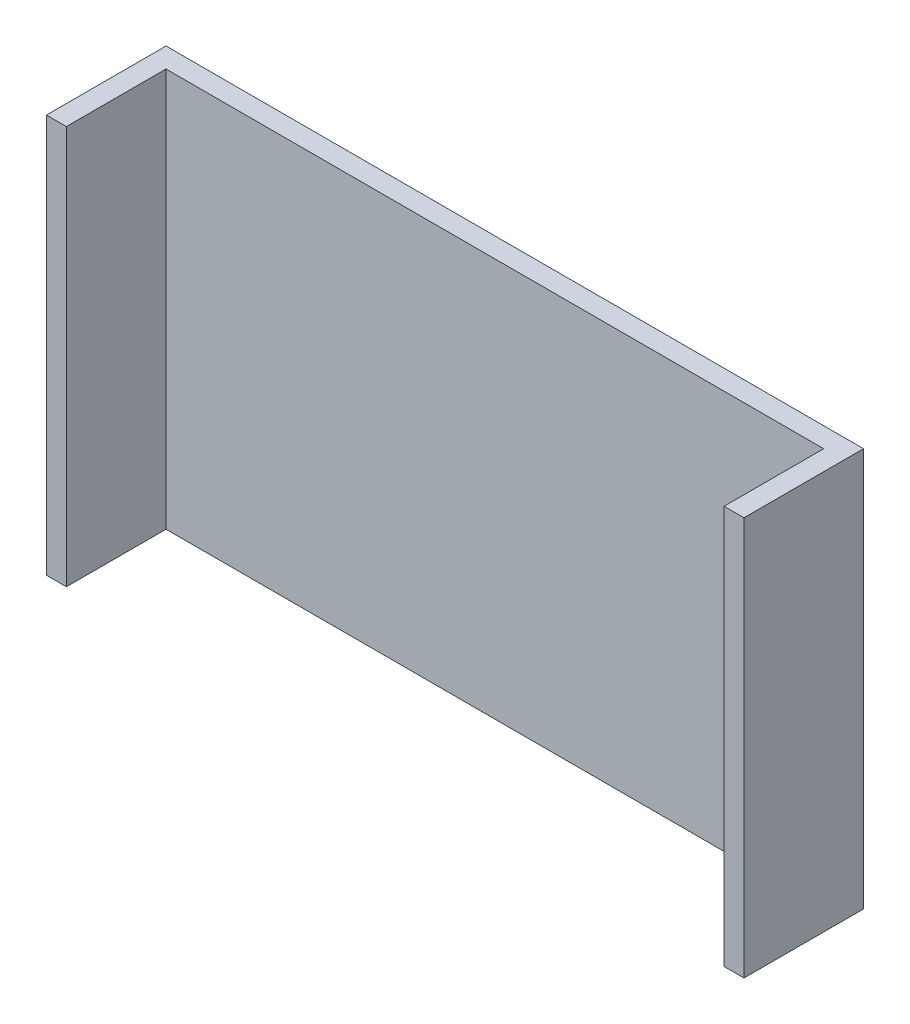
from build123d import *

# Parameters (mm, degrees)
SKETCH1_W           = 70
SKETCH1_H           = 40
BOSS_EXTRUDE1_DEPTH = 2
SKETCH2_W           = 2
SKETCH2_H           = 40
BOSS_EXTRUDE2_DEPTH = 10


with BuildPart() as part:
    # Sketch1 → Boss-Extrude1 (new body)
    with BuildSketch(Plane.XY):
        Rectangle(SKETCH1_W, SKETCH1_H)
    extrude(amount=BOSS_EXTRUDE1_DEPTH)

    # Sketch2 → Boss-Extrude2 (add)
    with BuildSketch(Plane.XY.offset(2)):
        with Locations((-34, 0)):
            Rectangle(SKETCH2_W, SKETCH2_H)
        with Locations((34, 0)):
            Rectangle(SKETCH2_W, SKETCH2_H)
    extrude(amount=BOSS_EXTRUDE2_DEPTH)


solid = part.part
